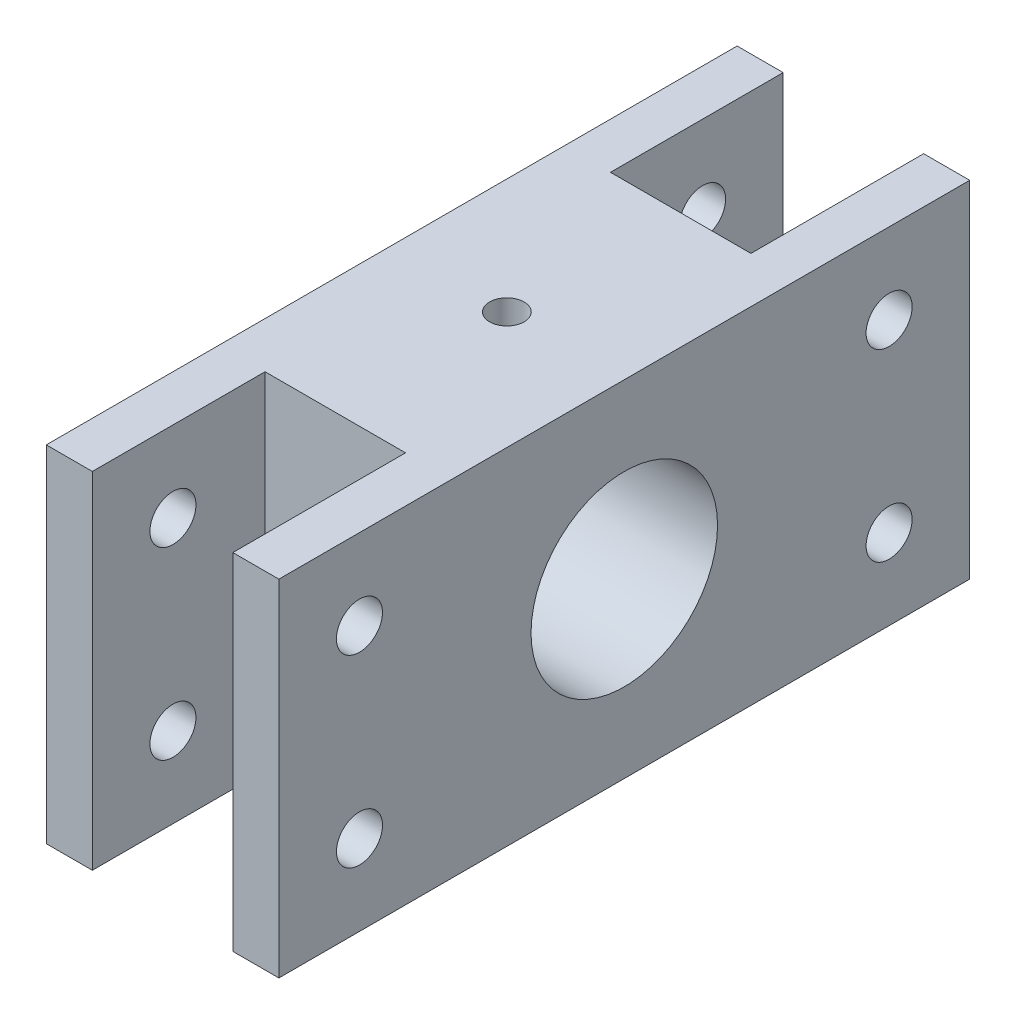
from build123d import *

# Parameters (mm, degrees)
SKETCH_1_W          = 60
SKETCH_1_H          = 30
SKETCH_1_R          = 2
EXTRUDE_1_DEPTH     = 20.2
SKETCH_2_W          = 12.2
SKETCH_2_H          = 15
CUT_EXTRUDE_1_DEPTH = 47.989786124
SKETCH_3_R          = 8.1
CUT_EXTRUDE_2_DEPTH = 40.154054707
SKETCH_4_R          = 1.5
CUT_EXTRUDE_3_DEPTH = 47.989786124


with BuildPart() as part:
    # 스케치1 → 보스-돌출1 (new body)
    with BuildSketch(Plane(origin=(0, 0, 0), x_dir=(0, 0, -1), z_dir=(1, 0, 0))):
        Rectangle(SKETCH_1_W, SKETCH_1_H)
        with Locations((-23, 8)):
            Circle(SKETCH_1_R, mode=Mode.SUBTRACT)
        with Locations(Location((-23, -8, 0), (0, 0, 180))):
            Circle(SKETCH_1_R, mode=Mode.SUBTRACT)
        with Locations((23, -8)):
            Circle(SKETCH_1_R, mode=Mode.SUBTRACT)
        with Locations(Location((23, 8, 0), (0, 0, 180))):
            Circle(SKETCH_1_R, mode=Mode.SUBTRACT)
    extrude(amount=EXTRUDE_1_DEPTH)

    # 스케치2 → 컷-돌출1 (cut, through all)
    with BuildSketch(Plane(origin=(0, 15, 0), x_dir=(1, 0, 0), z_dir=(0, 1, 0))):
        with Locations((10.1, 22.5)):
            Rectangle(SKETCH_2_W, SKETCH_2_H)
        with Locations((10.1, -22.5)):
            Rectangle(SKETCH_2_W, SKETCH_2_H)
    extrude(amount=-CUT_EXTRUDE_1_DEPTH, mode=Mode.SUBTRACT)

    # 스케치3 → 컷-돌출2 (cut, through all)
    with BuildSketch(Plane.ZY):
        Circle(SKETCH_3_R)
    extrude(amount=-CUT_EXTRUDE_2_DEPTH, mode=Mode.SUBTRACT)

    # 스케치4 → 컷-돌출3 (cut, through all)
    with BuildSketch(Plane(origin=(0, 15, 0), x_dir=(1, 0, 0), z_dir=(0, 1, 0))):
        with Locations(Location((10, 0, 0), (0, 0, 270))):
            Circle(SKETCH_4_R)
    extrude(amount=-CUT_EXTRUDE_3_DEPTH, mode=Mode.SUBTRACT)


solid = part.part
